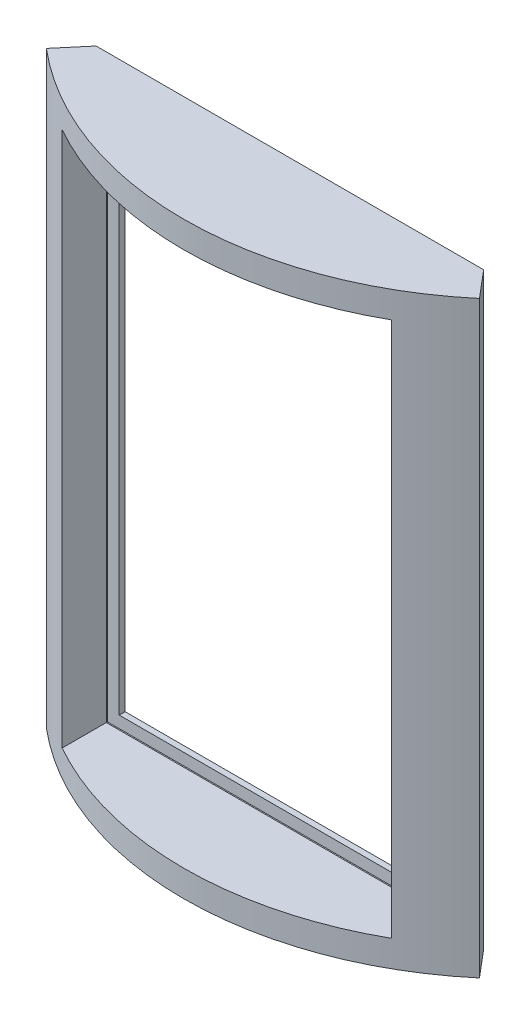
from build123d import *

# Parameters (mm, degrees)
BOSS_EXTRUDE1_DEPTH = 50
SKETCH2_W           = 56
SKETCH2_H           = 91
CUT_EXTRUDE1_DEPTH  = 65.651656333
CUT_EXTRUDE2_START  = -1
SKETCH3_W           = 60
SKETCH3_H           = 95
CUT_EXTRUDE2_DEPTH  = 2.2


with BuildPart() as part:
    # Sketch1 → Boss-Extrude1 (new, symmetric)
    with BuildSketch(Plane(origin=(0, 0, 0), x_dir=(1, 0, 0), z_dir=(0, 1, 0))):
        with BuildLine():
            Line((-36.796835842, -43.531515848), (-32.9234847, -38.949251022))
            Line((-32.9234847, -38.949251022), (32.9234847, -38.949251022))
            Line((32.9234847, -38.949251022), (36.796835842, -43.531515848))
            ThreePointArc((36.796835842, -43.531515848), (0, -57), (-36.796835842, -43.531515848))
        make_face()
    extrude(amount=BOSS_EXTRUDE1_DEPTH, both=True)

    # Sketch2 → Cut-Extrude1 (cut, through all)
    with BuildSketch(Plane(origin=(0, 0, 38.949251022), x_dir=(-1, 0, 0), z_dir=(0, 0, -1))):
        Rectangle(SKETCH2_W, SKETCH2_H)
    extrude(amount=-CUT_EXTRUDE1_DEPTH, mode=Mode.SUBTRACT)

    # Sketch3 → Cut-Extrude2 (cut)
    with BuildSketch(Plane(origin=(0, 0, 38.949251022), x_dir=(-1, 0, 0), z_dir=(0, 0, -1)).offset(CUT_EXTRUDE2_START)):
        Rectangle(SKETCH3_W, SKETCH3_H)
    extrude(amount=-CUT_EXTRUDE2_DEPTH, mode=Mode.SUBTRACT)


solid = part.part
